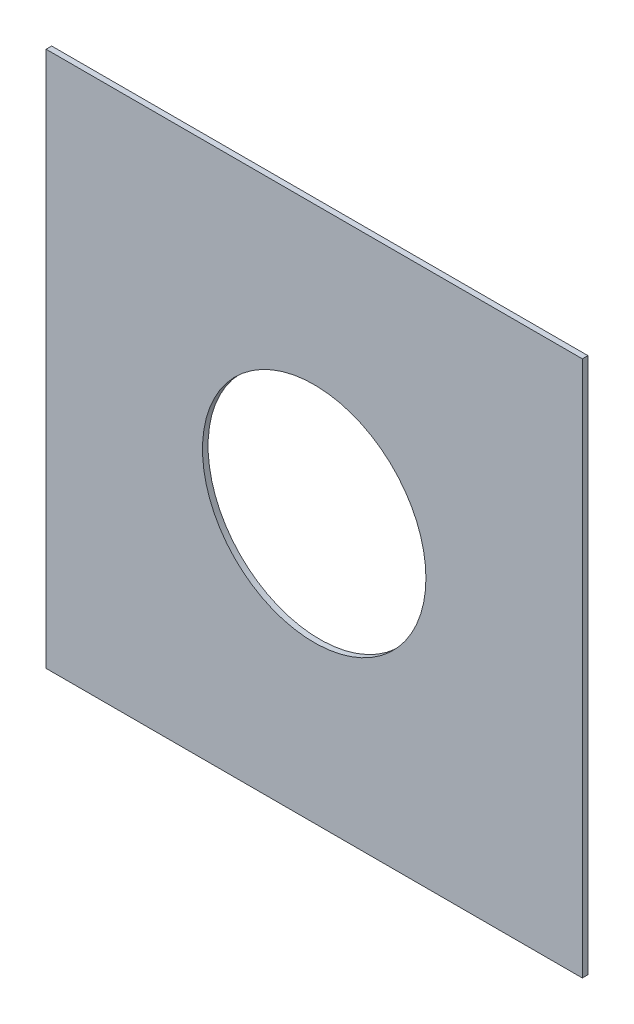
from build123d import *

# Parameters (mm, degrees)
SKETCH1_W           = 304.8
SKETCH1_H           = 304.8
SKETCH1_R           = 63.5
BOSS_EXTRUDE1_DEPTH = 3.175


with BuildPart() as part:
    # Sketch1 → Boss-Extrude1 (new body)
    with BuildSketch(Plane.XY):
        Rectangle(SKETCH1_W, SKETCH1_H)
        Circle(SKETCH1_R, mode=Mode.SUBTRACT)
    extrude(amount=BOSS_EXTRUDE1_DEPTH)


solid = part.part
